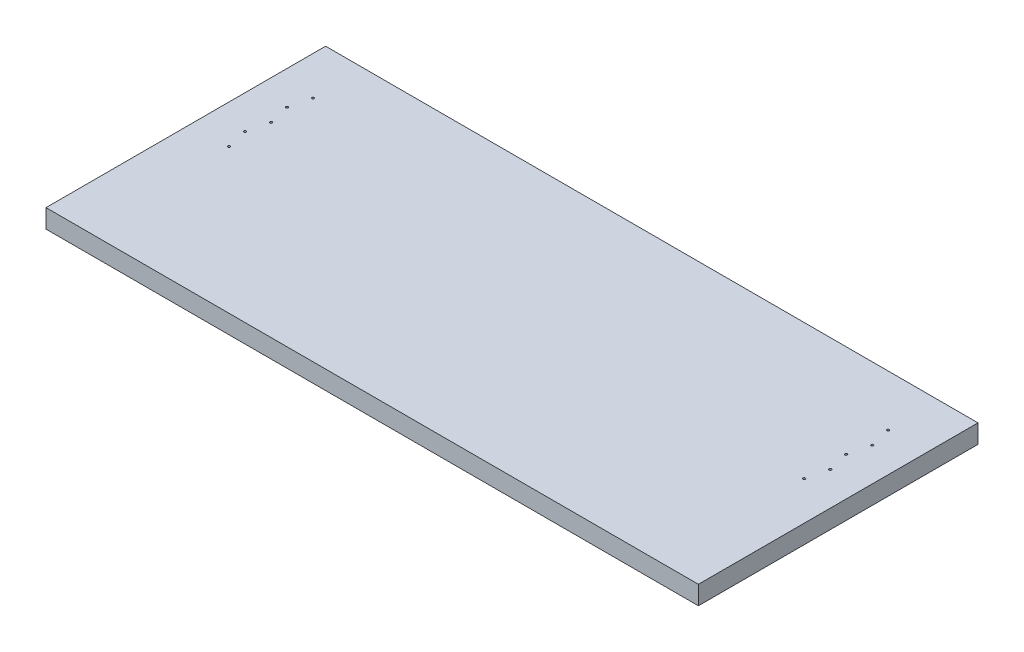
from build123d import *

# Parameters (mm, degrees)
SKETCH1_W           = 1400
SKETCH1_H           = 600
BOSS_EXTRUDE1_DEPTH = 40
SKETCH2_R           = 2.5
CUT_EXTRUDE9_DEPTH  = 70


with BuildPart() as part:
    # Sketch1 → Boss-Extrude1 (new body)
    with BuildSketch(Plane(origin=(0, 0, 0), x_dir=(1, 0, 0), z_dir=(0, 1, 0))):
        Rectangle(SKETCH1_W, SKETCH1_H)
    extrude(amount=BOSS_EXTRUDE1_DEPTH)

    # Sketch2 → Cut-Extrude9 (cut)
    with BuildSketch(Plane(origin=(0, 0, 0), x_dir=(1, 0, 0), z_dir=(0, 1, 0))):
        with Locations(Location((617, 10, 0), (0, 0, 90))):
            Circle(SKETCH2_R)
        with Locations(Location((628, 55, 0), (0, 0, 90))):
            Circle(SKETCH2_R)
        with Locations(Location((617, 100, 0), (0, 0, 90))):
            Circle(SKETCH2_R)
        with Locations(Location((628, 145, 0), (0, 0, 90))):
            Circle(SKETCH2_R)
        with Locations(Location((617, 190, 0), (0, 0, 90))):
            Circle(SKETCH2_R)
    cut_extrude9 = extrude(amount=CUT_EXTRUDE9_DEPTH, mode=Mode.SUBTRACT)

    # Mirror1: Cut-Extrude9 across plane
    add(cut_extrude9.mirror(Plane.ZY), mode=Mode.SUBTRACT)


solid = part.part
